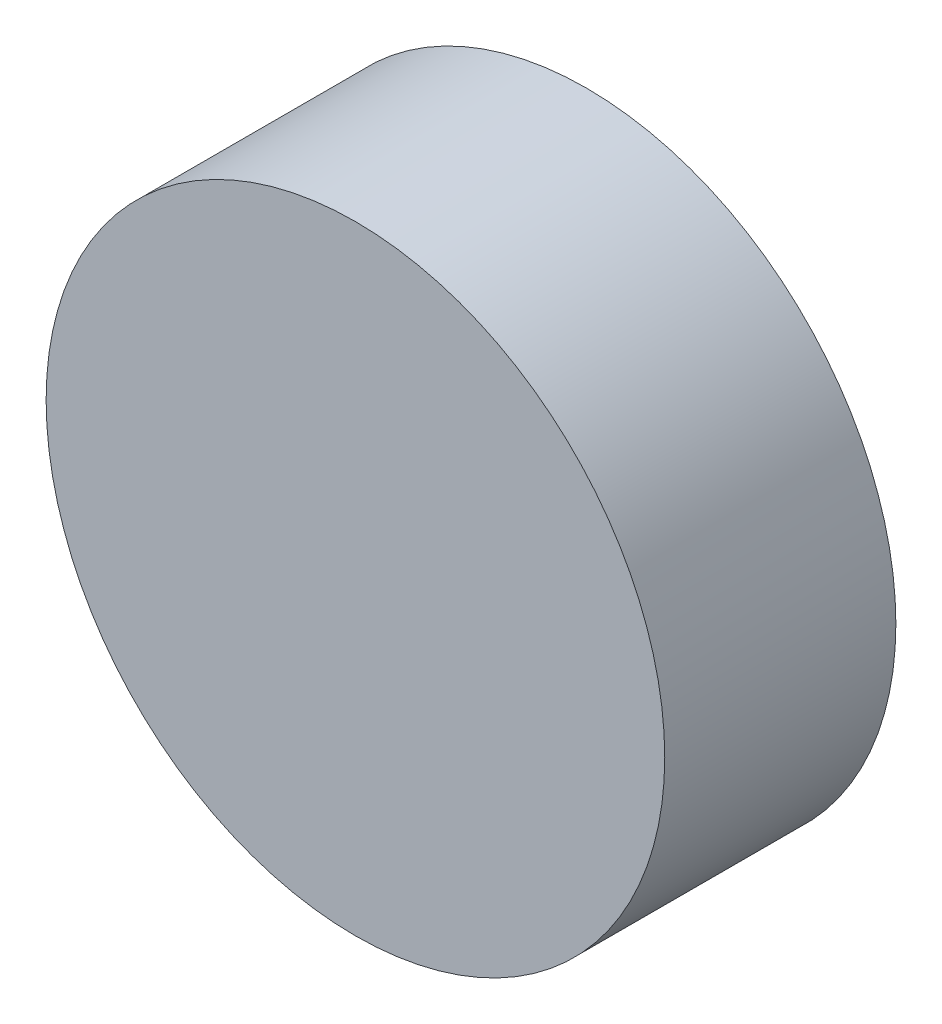
from build123d import *

# Parameters (mm, degrees)
SKETCH1_R           = 8.03
BOSS_EXTRUDE1_DEPTH = 6


with BuildPart() as part:
    # Sketch1 → Boss-Extrude1 (new body)
    with BuildSketch(Plane.XY):
        Circle(SKETCH1_R)
    extrude(amount=BOSS_EXTRUDE1_DEPTH)


solid = part.part
